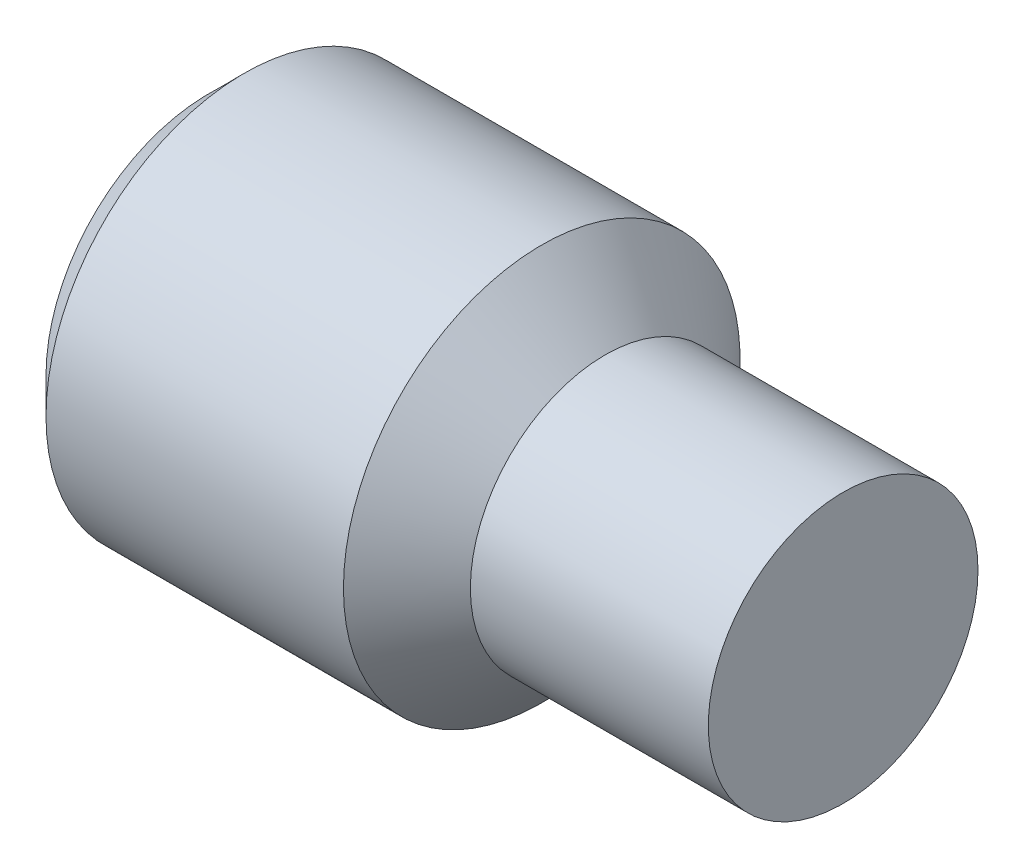
from build123d import *

# Parameters (mm, degrees)
SKETCH_1_R          = 5
EXTRUDE_1_DEPTH     = 16
CUT_EXTRUDE_1_DEPTH = 6
CUT_EXTRUDE_START   = -6
SKETCH_3_R          = 5
SKETCH_3_R_2        = 3.4
CUT_EXTRUDE_2_DEPTH = 6


with BuildPart() as part:
    # Эскиз1 → Вытянуть1 (new body)
    with BuildSketch(Plane(origin=(0, 0, 0), x_dir=(0, 0, -1), z_dir=(1, 0, 0))):
        Circle(SKETCH_1_R)
    extrude(amount=EXTRUDE_1_DEPTH)

    # Эскиз2 → Вырез-Вытянуть1 (cut)
    with BuildSketch(Plane.ZY):
        Polygon((-2.5, -1.443375673), (0, -2.886751346), (0, 2.886751346), (-2.5, 1.443375673), align=None)
        Polygon((0, -2.886751346), (0, 2.886751346), (2.5, 1.443375673), (2.5, -1.443375673), align=None)
    extrude(amount=-CUT_EXTRUDE_1_DEPTH, mode=Mode.SUBTRACT)

    # Эскиз3 → Вырез-Вытянуть2 (cut)
    with BuildSketch(Plane(origin=(16, 0, 0), x_dir=(0, 0, -1), z_dir=(1, 0, 0)).offset(CUT_EXTRUDE_START)):
        Circle(SKETCH_3_R)
        Circle(SKETCH_3_R_2, mode=Mode.SUBTRACT)
    extrude(amount=CUT_EXTRUDE_2_DEPTH, mode=Mode.SUBTRACT)

    # Эскиз4 → Вырез-Повернуть1 (revolve, cut)
    with BuildSketch(Plane.XY, mode=Mode.PRIVATE) as cut_revolve_1_sk:
        Polygon((10, 5), (10, 3.4), (8.4, 5), align=None)
    revolve(cut_revolve_1_sk.sketch.rotate(Axis((0, 0, 0), (1, 0, 0)), 90), axis=Axis((0, 0, 0), (1, 0, 0)), mode=Mode.SUBTRACT)

    # Эскиз5 → Вырез-Повернуть2 (revolve, cut)
    with BuildSketch(Plane.XY, mode=Mode.PRIVATE) as cut_revolve_2_sk:
        Polygon((0, 5), (0, 4.1), (0.9, 5), align=None)
    revolve(cut_revolve_2_sk.sketch.rotate(Axis((0, 0, 0), (1, 0, 0)), 90), axis=Axis((0, 0, 0), (1, 0, 0)), mode=Mode.SUBTRACT)


solid = part.part
